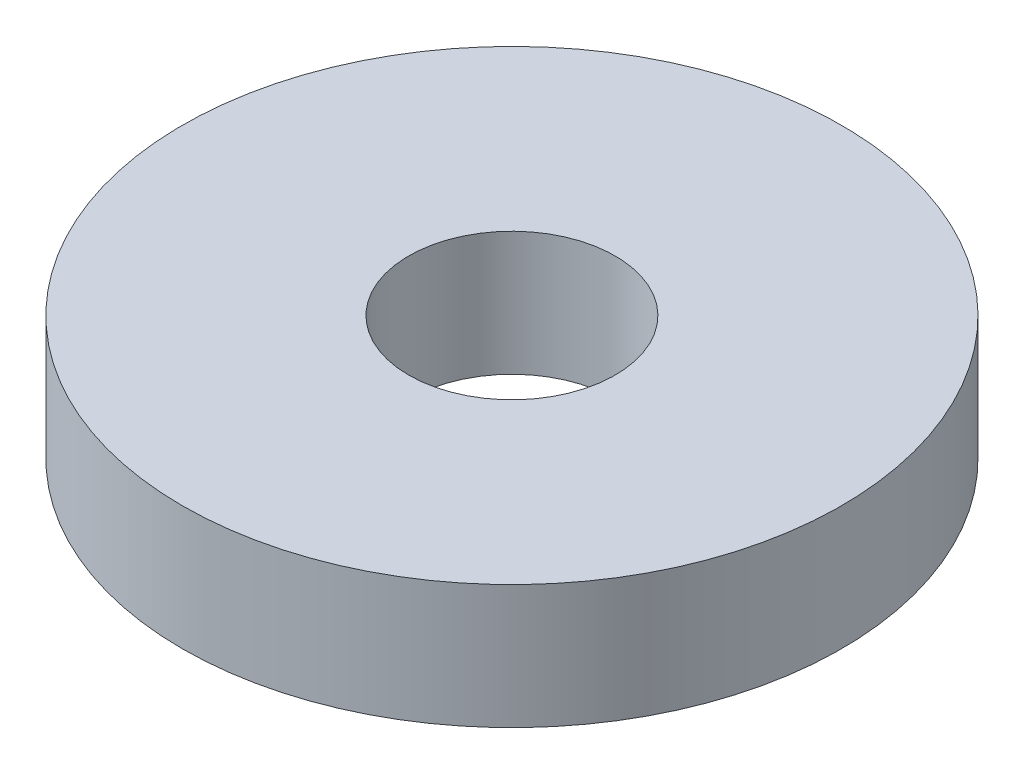
from build123d import *

# Parameters (mm, degrees)
SKETCH2_R           = 7.98
SKETCH2_R_2         = 2.5
BOSS_EXTRUDE1_DEPTH = 3


with BuildPart() as part:
    # Sketch2 → Boss-Extrude1 (new body)
    with BuildSketch(Plane(origin=(0, 0, 0), x_dir=(1, 0, 0), z_dir=(0, 1, 0))):
        with Locations(Location((0, 0, 0), (0, 0, 270))):
            Circle(SKETCH2_R)
        with Locations(Location((0, 0, 0), (0, 0, 270))):
            Circle(SKETCH2_R_2, mode=Mode.SUBTRACT)
    extrude(amount=BOSS_EXTRUDE1_DEPTH)


solid = part.part
